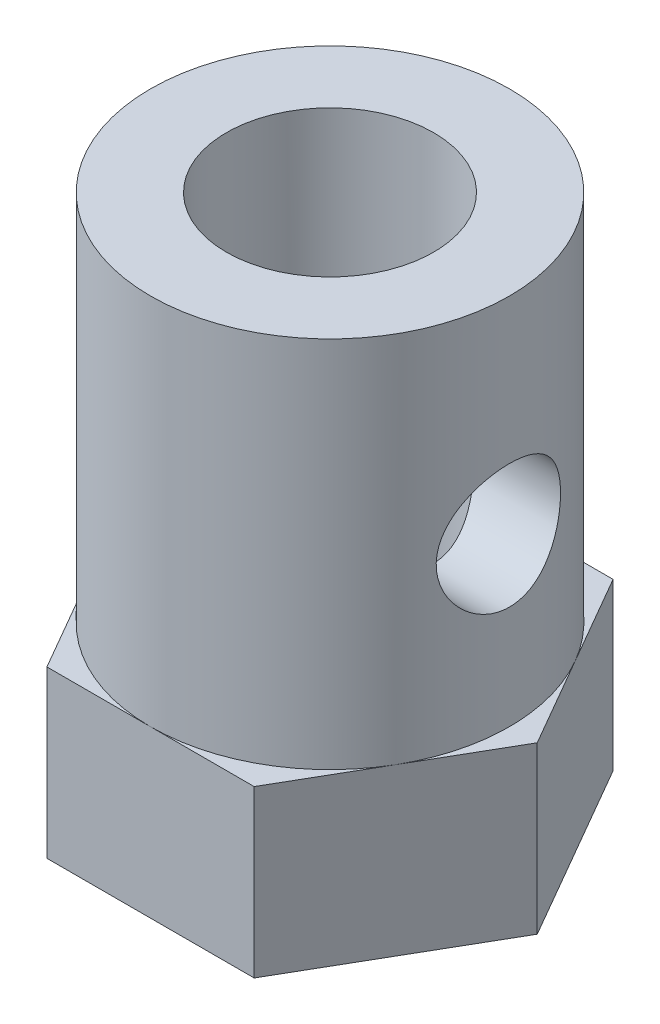
from build123d import *

# Parameters (mm, degrees)
EXTRUDE_1_DEPTH          = 4
SKETCH_3_R               = 4.330127019
SKETCH_3_R_2             = 2.5
EXTRUDE_2_DEPTH          = 9
SKETCH_4_R               = 1.5
CUT_EXTRUDE_1_DEPTH      = 15
CUT_EXTRUDE_2_DEPTH      = 15.585952146
CUT_EXTRUDE_2_DEPTH_BACK = 15.585952146
SKETCH_5_R               = 1.5


with BuildPart() as part:
    # 草图2 → 凸台-拉伸1 (new body)
    with BuildSketch(Plane(origin=(0, 0, 0), x_dir=(1, 0, 0), z_dir=(0, 1, 0))):
        Polygon((0, 0), (-2.5, 4.330127019), (-5, 0), align=None)
        Polygon((-2.5, -4.330127019), (-5, 0), (0, 0), align=None)
        Polygon((0, 0), (-2.5, -4.330127019), (2.5, -4.330127019), align=None)
        Polygon((0, 0), (2.5, -4.330127019), (5, 0), align=None)
        Polygon((0, 0), (5, 0), (2.5, 4.330127019), align=None)
        Polygon((0, 0), (2.5, 4.330127019), (-2.5, 4.330127019), align=None)
    extrude(amount=EXTRUDE_1_DEPTH)

    # 草图3 → 凸台-拉伸2 (add)
    with BuildSketch(Plane(origin=(0, 4, 0), x_dir=(1, 0, 0), z_dir=(0, 1, 0))):
        with Locations(Location((0, 0, 0), (0, 0, 270))):
            Circle(SKETCH_3_R)
        with Locations(Location((0, 0, 0), (0, 0, 270))):
            Circle(SKETCH_3_R_2, mode=Mode.SUBTRACT)
    extrude(amount=EXTRUDE_2_DEPTH)

    # 草图4 → 切除-拉伸1 (cut)
    with BuildSketch(Plane.XZ):
        with Locations(Location((0, 0, 0), (0, 0, 270))):
            Circle(SKETCH_4_R)
    extrude(amount=-CUT_EXTRUDE_1_DEPTH, mode=Mode.SUBTRACT)

    # 草图5 → 切除-拉伸2 (cut, two sides: drawn at the far end of the back side and taken through both)
    with BuildSketch(Plane(origin=(0, 0, 0), x_dir=(0, 0, -1), z_dir=(1, 0, 0)).offset(-CUT_EXTRUDE_2_DEPTH_BACK)):
        with Locations((0, 8)):
            Circle(SKETCH_5_R)
    extrude(amount=CUT_EXTRUDE_2_DEPTH + CUT_EXTRUDE_2_DEPTH_BACK, mode=Mode.SUBTRACT)


solid = part.part
